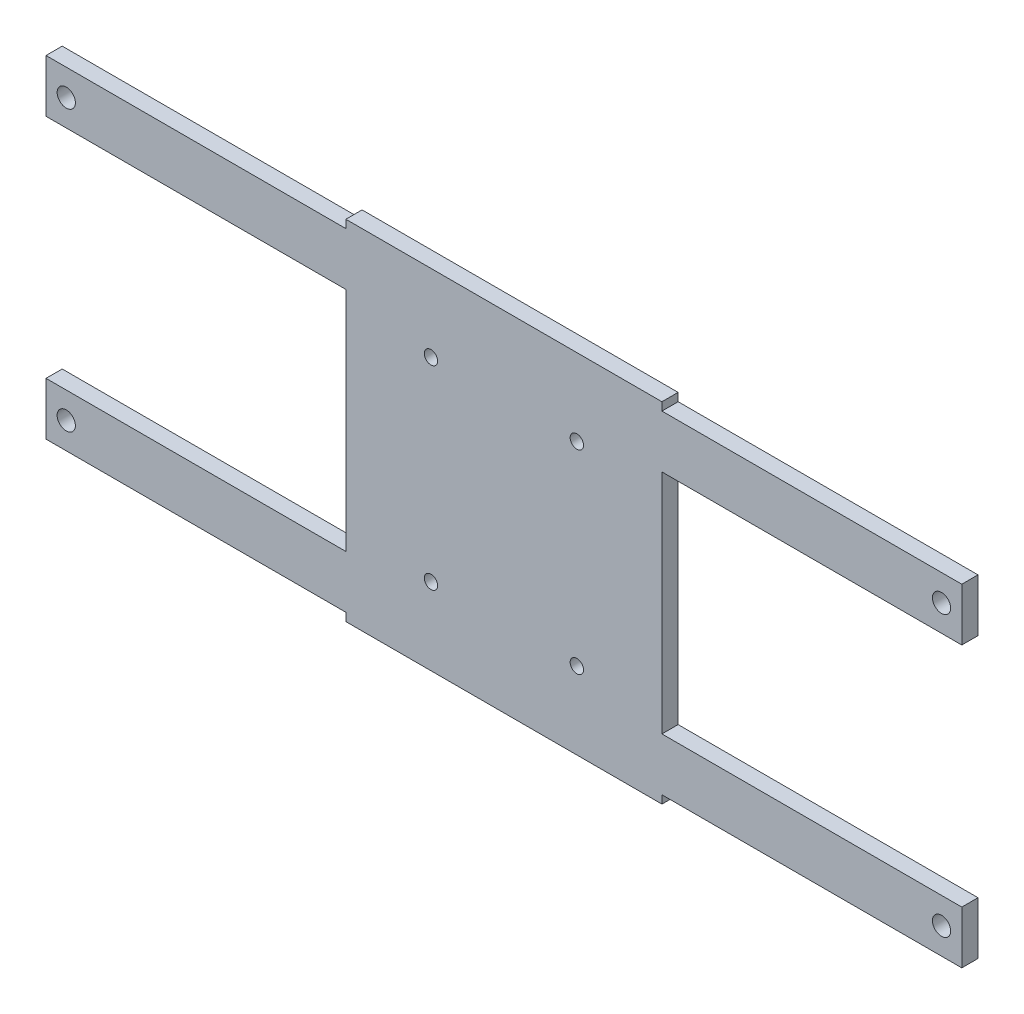
from build123d import *

# Parameters (mm, degrees)
SENSOR_BRIDGE_DEPTH      = 4
DECK_COLUMNS_M4_START    = -1
SKETCH_DECK_COLUMNS_M4_R = 2.25
DECK_COLUMNS_M4_DEPTH    = 6
MID360_MOUNT_START       = -1
SKETCH_MID360_MOUNT_R    = 1.65
MID360_MOUNT_DEPTH       = 6


with BuildPart() as part:
    # Sketch_Sensor_bridge → Sensor_bridge (new body)
    with BuildSketch(Plane.XY):
        Polygon((113, -28), (113, -41), (39, -41), (39, -43), (-39, -43), (-39, -41), (-113, -41), (-113, -28), (-39, -28), (-39, 28), (-113, 28), (-113, 41), (-39, 41), (-39, 43), (39, 43), (39, 41), (113, 41), (113, 28), (39, 28), (39, -28), align=None)
    extrude(amount=SENSOR_BRIDGE_DEPTH)

    # Sketch_Deck_columns_M4 → Deck_columns_M4 (cut)
    with BuildSketch(Plane.XY.offset(DECK_COLUMNS_M4_START)):
        with Locations(Location((-108, -34.5, 0), (0, 0, 180))):
            Circle(SKETCH_DECK_COLUMNS_M4_R)
        with Locations(Location((-108, 34.5, 0), (0, 0, 180))):
            Circle(SKETCH_DECK_COLUMNS_M4_R)
        with Locations(Location((108, -34.5, 0), (0, 0, 180))):
            Circle(SKETCH_DECK_COLUMNS_M4_R)
        with Locations(Location((108, 34.5, 0), (0, 0, 180))):
            Circle(SKETCH_DECK_COLUMNS_M4_R)
    extrude(amount=DECK_COLUMNS_M4_DEPTH, mode=Mode.SUBTRACT)

    # Sketch_MID360_mount → MID360_mount (cut)
    with BuildSketch(Plane.XY.offset(MID360_MOUNT_START)):
        with Locations(Location((-18, -24, 0), (0, 0, 180))):
            Circle(SKETCH_MID360_MOUNT_R)
        with Locations(Location((-18, 24, 0), (0, 0, 180))):
            Circle(SKETCH_MID360_MOUNT_R)
        with Locations(Location((18, -24, 0), (0, 0, 180))):
            Circle(SKETCH_MID360_MOUNT_R)
        with Locations(Location((18, 24, 0), (0, 0, 180))):
            Circle(SKETCH_MID360_MOUNT_R)
    extrude(amount=MID360_MOUNT_DEPTH, mode=Mode.SUBTRACT)


solid = part.part
